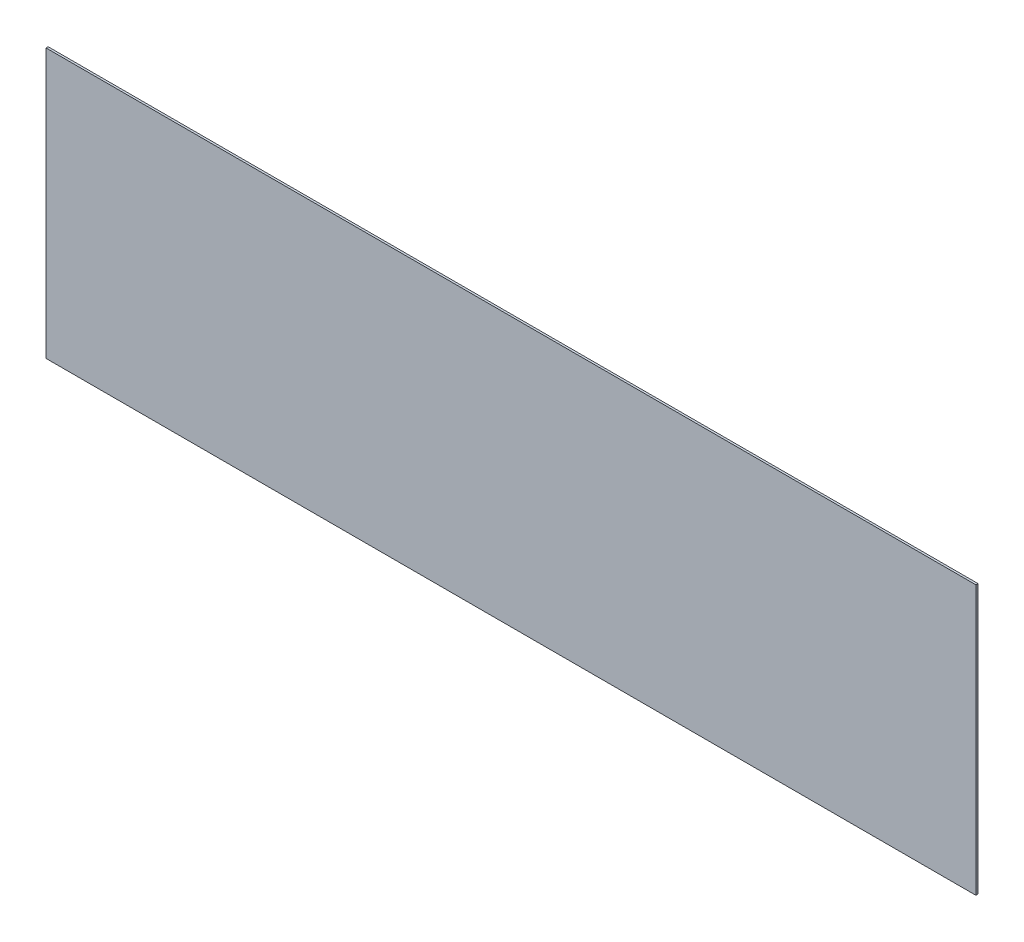
from build123d import *

# Parameters (mm, degrees)
TOPPING_PLINT_ARKA_1_START = -798.5
SKETCH1_W                  = 657
SKETCH1_H                  = 190
TOPPING_PLINT_ARKA_1_DEPTH = 1.5


with BuildPart() as part:
    # Sketch1 → TOPPING_plint_arka_1 (new body)
    with BuildSketch(Plane.XY.offset(TOPPING_PLINT_ARKA_1_START)):
        with Locations((350, 105)):
            Rectangle(SKETCH1_W, SKETCH1_H)
    extrude(amount=-TOPPING_PLINT_ARKA_1_DEPTH)


solid = part.part
